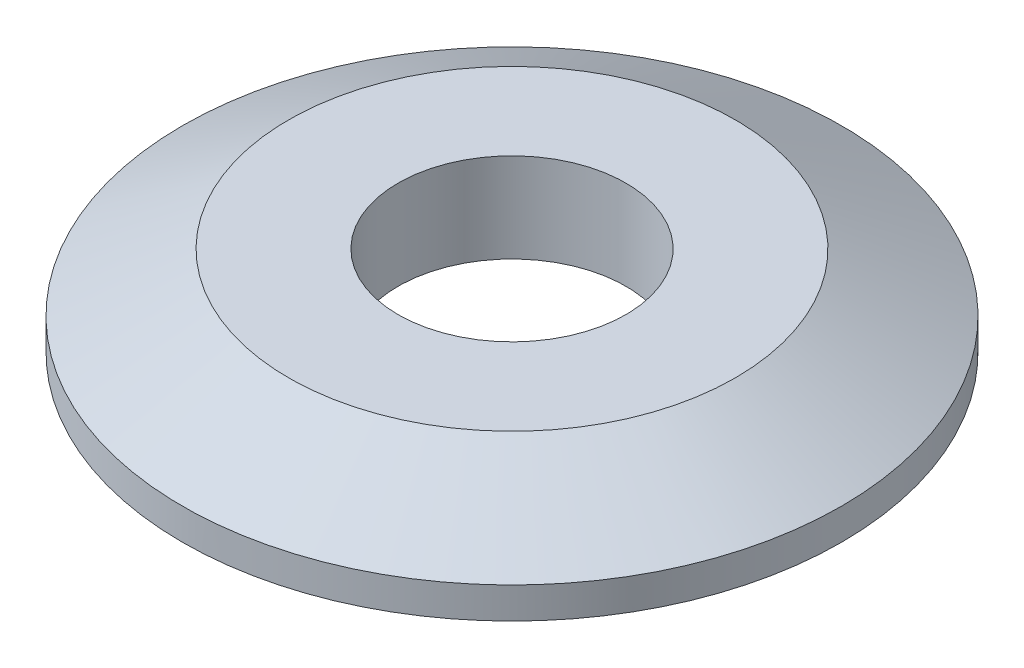
from build123d import *

# Parameters (mm, degrees)
SKETCH1_R           = 7.375
SKETCH1_R_2         = 2.55
BOSS_EXTRUDE1_DEPTH = 2


with BuildPart() as part:
    # Sketch1 → Boss-Extrude1 (new body)
    with BuildSketch(Plane(origin=(0, 0, 0), x_dir=(1, 0, 0), z_dir=(0, 1, 0))):
        with Locations(Location((0, 0, 0), (0, 0, 270))):
            Circle(SKETCH1_R)
        with Locations(Location((0, 0, 0), (0, 0, 270))):
            Circle(SKETCH1_R_2, mode=Mode.SUBTRACT)
    extrude(amount=BOSS_EXTRUDE1_DEPTH)

    # Sketch2 → Cut-Revolve1 (revolve, cut)
    with BuildSketch(Plane.XY):
        Polygon((5, 2), (7.375, 0.7), (7.375, 2), align=None)
    revolve(axis=Axis((0, 0, 0), (0, 1, 0)), mode=Mode.SUBTRACT)


solid = part.part
